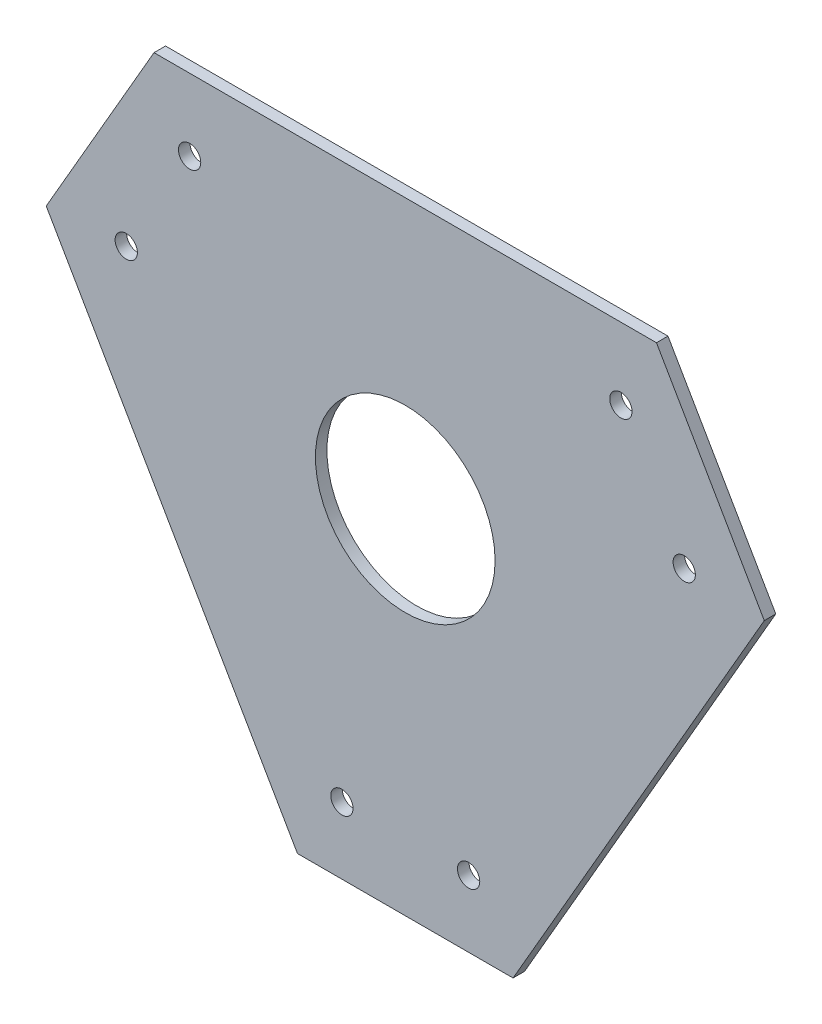
from build123d import *

# Parameters (mm, degrees)
SKETCH1_R           = 1.55
SKETCH1_R_2         = 12.5
BOSS_EXTRUDE1_DEPTH = 1.6


with BuildPart() as part:
    # Sketch1 → Boss-Extrude1 (new body)
    with BuildSketch(Plane.XY):
        Polygon((-34.951905284, 37.5), (34.951905284, 37.5), (49.951905284, 11.519237886), (15, -49.019237886), (-15, -49.019237886), (-49.951905284, 11.519237886), align=None)
        with Locations((-30, 27.5)):
            Circle(SKETCH1_R, mode=Mode.SUBTRACT)
        with Locations((30, 27.5)):
            Circle(SKETCH1_R, mode=Mode.SUBTRACT)
        with Locations((38.815698604, 12.230762114)):
            Circle(SKETCH1_R, mode=Mode.SUBTRACT)
        with Locations((8.815698604, -39.730762114)):
            Circle(SKETCH1_R, mode=Mode.SUBTRACT)
        with Locations((-8.815698604, -39.730762114)):
            Circle(SKETCH1_R, mode=Mode.SUBTRACT)
        with Locations((-38.815698604, 12.230762114)):
            Circle(SKETCH1_R, mode=Mode.SUBTRACT)
        Circle(SKETCH1_R_2, mode=Mode.SUBTRACT)
    extrude(amount=BOSS_EXTRUDE1_DEPTH)


solid = part.part
